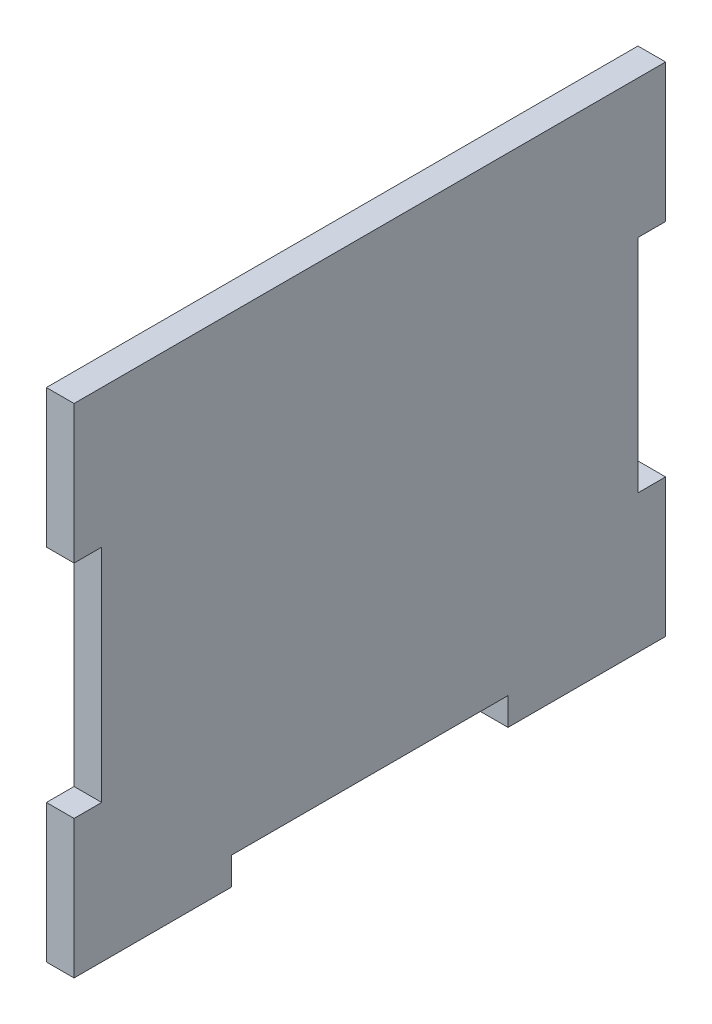
from build123d import *

# Parameters (mm, degrees)
SKETCH1_W           = 107
SKETCH1_H           = 90
BOSS_EXTRUDE1_DEPTH = 5
SKETCH5_W           = 5
SKETCH5_H           = 40
SKETCH5_W_2         = 50
SKETCH5_H_2         = 5
CUT_EXTRUDE2_DEPTH  = 140.907112042
SKETCH6_W           = 102
SKETCH6_H           = 3
CUT_EXTRUDE3_DEPTH  = 2.5


with BuildPart() as part:
    # Sketch1 → Boss-Extrude1 (new body)
    with BuildSketch(Plane(origin=(0, 0, 0), x_dir=(0, 0, -1), z_dir=(1, 0, 0))):
        with Locations((53.5, 45)):
            Rectangle(SKETCH1_W, SKETCH1_H)
    extrude(amount=BOSS_EXTRUDE1_DEPTH)

    # Sketch5 → Cut-Extrude2 (cut, through all)
    with BuildSketch(Plane.ZY):
        with Locations((-104.5, 45)):
            Rectangle(SKETCH5_W, SKETCH5_H)
        with Locations((-2.5, 45)):
            Rectangle(SKETCH5_W, SKETCH5_H)
        with Locations((-53.5, 2.5)):
            Rectangle(SKETCH5_W_2, SKETCH5_H_2)
    extrude(amount=-CUT_EXTRUDE2_DEPTH, mode=Mode.SUBTRACT)

    # Sketch6 → Cut-Extrude3 (cut)
    with BuildSketch(Plane.ZY):
        with Locations((-53.5, 86)):
            Rectangle(SKETCH6_W, SKETCH6_H)
    extrude(amount=-CUT_EXTRUDE3_DEPTH, mode=Mode.SUBTRACT)


solid = part.part
